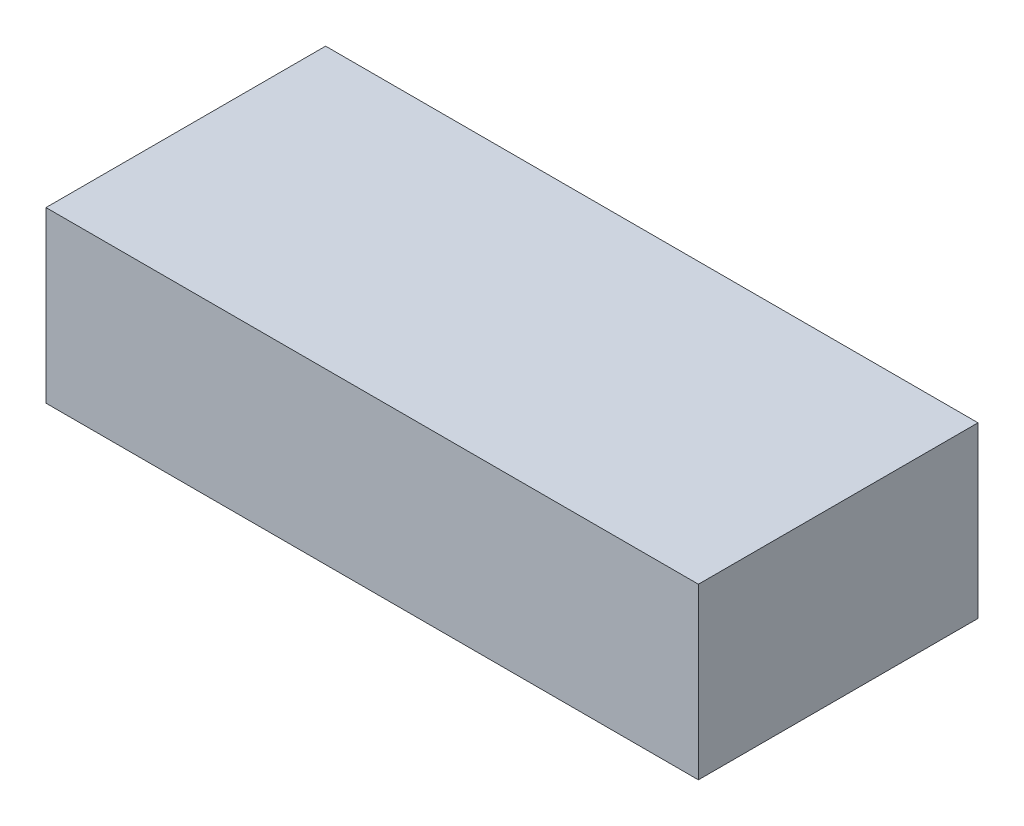
from build123d import *

# Parameters (mm, degrees)
SKETCH1_W           = 77
SKETCH1_H           = 33
BOSS_EXTRUDE1_DEPTH = 20


with BuildPart() as part:
    # Sketch1 → Boss-Extrude1 (new body)
    with BuildSketch(Plane(origin=(0, 0, 0), x_dir=(1, 0, 0), z_dir=(0, 1, 0))):
        with Locations((38.5, 16.5)):
            Rectangle(SKETCH1_W, SKETCH1_H)
    extrude(amount=BOSS_EXTRUDE1_DEPTH)


solid = part.part
